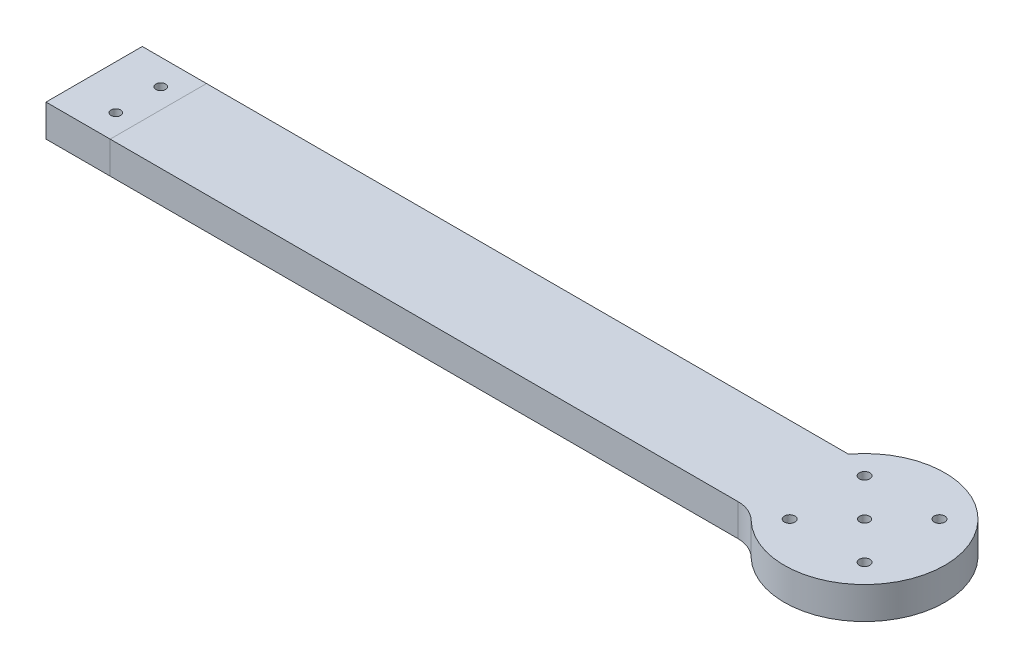
from build123d import *

# Parameters (mm, degrees)
BOSS_EXTRUDE1_DEPTH     = 10
SKETCH4_W               = 30
SKETCH4_H               = 10
BOSS_EXTRUDE3_DEPTH     = 20
SKETCH5_R               = 1.5
CUT_EXTRUDE1_DEPTH      = 10
SKETCH6_R               = 1.65
SKETCH6_R_2             = 1.55
DRONE_MOUNT_HOLES_DEPTH = 10
FILLET2_R               = 10


with BuildPart() as part:
    # Sketch2 → Boss-Extrude1 (new body)
    with BuildSketch(Plane(origin=(0, 0, 0), x_dir=(1, 0, 0), z_dir=(0, 1, 0))):
        with BuildLine():
            Line((0, 0), (200, 0))
            ThreePointArc((200, 0), (245, 15), (200, 30))
            Line((200, 30), (0, 30))
            Line((0, 30), (0, 0))
        make_face()
    extrude(amount=BOSS_EXTRUDE1_DEPTH)

    # Sketch6 → Drone Mount Holes (cut)
    with BuildSketch(Plane(origin=(0, 10, 0), x_dir=(1, 0, 0), z_dir=(0, 1, 0))):
        with Locations(Location((231.66726189, 26.66726189, 0), (0, 0, 270))):
            Circle(SKETCH6_R)
        with Locations(Location((231.66726189, 3.33273811, 0), (0, 0, 270))):
            Circle(SKETCH6_R)
        with Locations(Location((208.33273811, 3.33273811, 0), (0, 0, 270))):
            Circle(SKETCH6_R)
        with Locations(Location((208.33273811, 26.66726189, 0), (0, 0, 270))):
            Circle(SKETCH6_R)
        with Locations(Location((220, 15, 0), (0, 0, 270))):
            Circle(SKETCH6_R_2)
    extrude(amount=-DRONE_MOUNT_HOLES_DEPTH, mode=Mode.SUBTRACT)

    # Fillet2
    fillet2_edges = [part.edges().sort_by_distance(p)[0] for p in [
        (200, 5, 0),
    ]]
    fillet(fillet2_edges, radius=FILLET2_R)


with BuildPart() as body_2:
    # Sketch4 → Boss-Extrude3 (new body)
    with BuildSketch(Plane.ZY):
        with Locations((-15, 5)):
            Rectangle(SKETCH4_W, SKETCH4_H)
    extrude(amount=BOSS_EXTRUDE3_DEPTH)

    # Sketch5 → Cut-Extrude1 (cut)
    with BuildSketch(Plane(origin=(0, 10, 0), x_dir=(1, 0, 0), z_dir=(0, 1, 0))):
        with Locations(Location((-6.25, 22, 0), (0, 0, 270))):
            Circle(SKETCH5_R)
        with Locations(Location((-6.25, 8, 0), (0, 0, 270))):
            Circle(SKETCH5_R)
    extrude(amount=-CUT_EXTRUDE1_DEPTH, mode=Mode.SUBTRACT)


solid = Compound([part.part, body_2.part])
